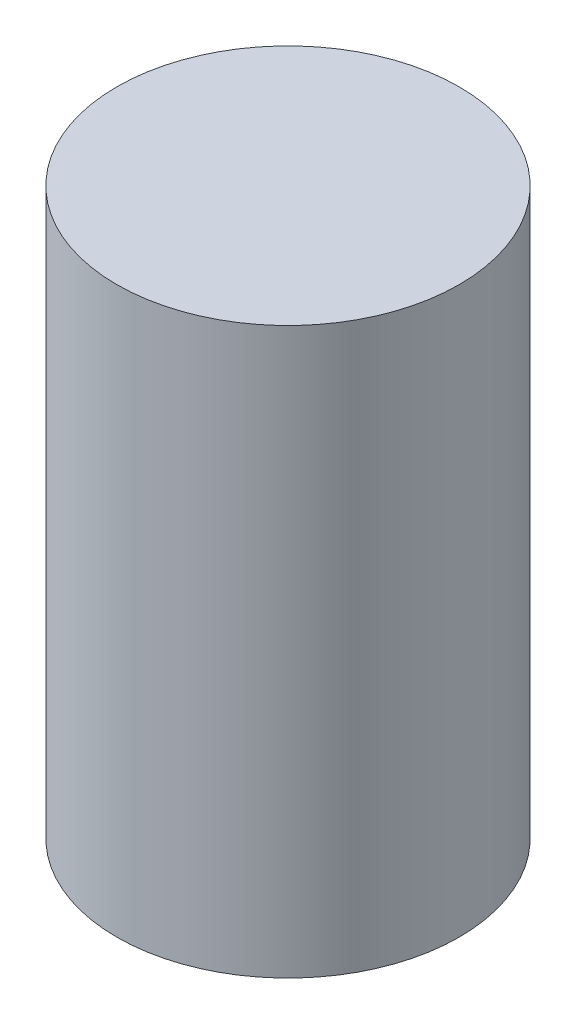
from build123d import *

# Parameters (mm, degrees)
SKETCH1_R           = 50
BOSS_EXTRUDE1_DEPTH = 165
SCALE1_SCALE        = 0.75


with BuildPart() as part:
    # Sketch1 → Boss-Extrude1 (new body)
    with BuildSketch(Plane(origin=(0, 0, 0), x_dir=(1, 0, 0), z_dir=(0, 1, 0))):
        with Locations(Location((0, 0, 0), (0, 0, 270))):
            Circle(SKETCH1_R)
    extrude(amount=BOSS_EXTRUDE1_DEPTH)


with BuildPart() as part_1:
    # Scale1: scaled about (0, 82.5, 0)
    add(part.part.scale(SCALE1_SCALE).moved(Location((0, 20.625, 0))))


solid = part_1.part
